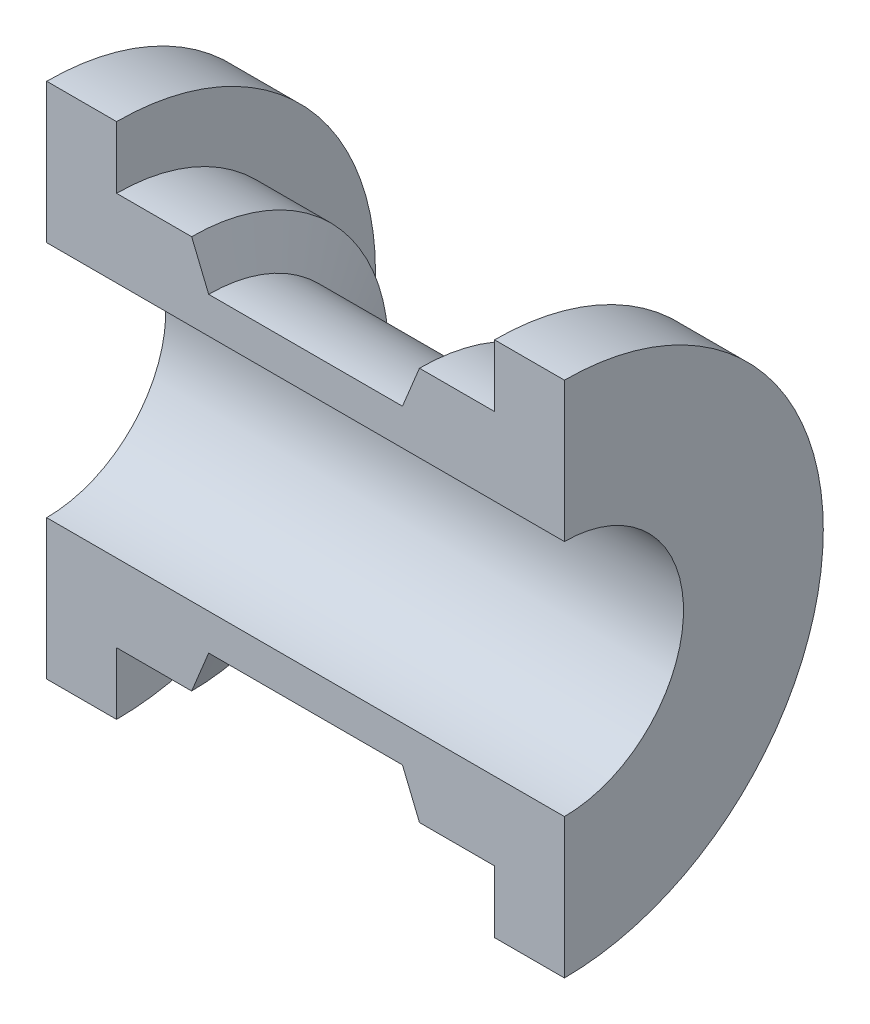
from build123d import *

# Parameters (mm, degrees)
REVOLVE1_ANGLE = 180
SKETCH2_W      = 3
SKETCH2_H      = 7.753714539


with BuildPart() as part:
    # Sketch1 → Revolve1 (revolve)
    with BuildSketch(Plane.XY):
        Polygon((-25, -11.5), (25, -11.5), (25, -25), (18.25, -25), (18.25, -19), (11, -19), (9.357289528, -15), (-9.357289528, -15), (-11, -19), (-18.25, -19), (-18.25, -25), (-25, -25), align=None)
    revolve(axis=Axis((-23.878950705, 0, 0), (1, 0, 0)), revolution_arc=REVOLVE1_ANGLE)


with BuildPart() as body_2:
    # Sketch2 → Revolve2 (revolve)
    with BuildSketch(Plane(origin=(0, 0, 0), x_dir=(1, 0, 0), z_dir=(0, 1, 0)), mode=Mode.PRIVATE) as revolve2_sk:
        with Locations((-1.5, 16.12314273)):
            Rectangle(SKETCH2_W, SKETCH2_H)
    revolve(revolve2_sk.sketch.rotate(Axis((0, 0, 0), (0, 0, -1)), 180), axis=Axis((0, 0, 0), (0, 0, -1)))


solid = Compound([part.part, body_2.part])
